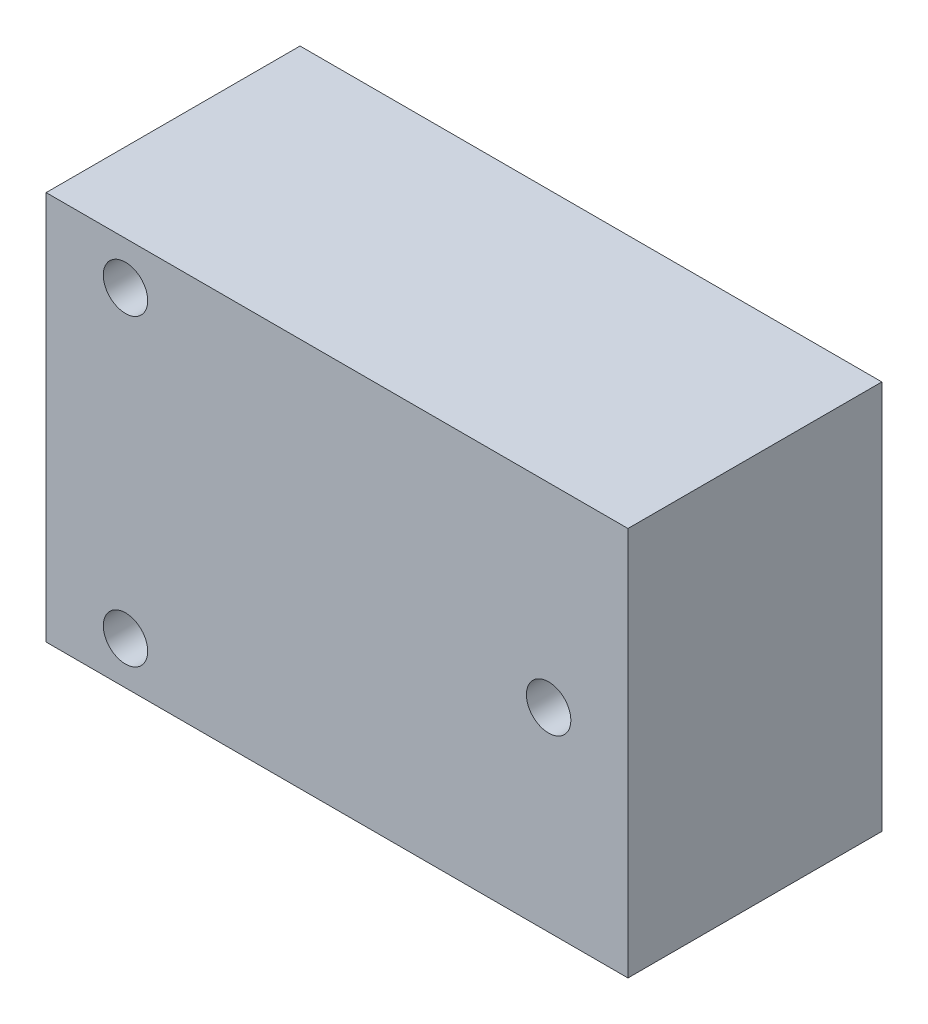
from build123d import *

# Parameters (mm, degrees)
SKETCH_1_W      = 55
SKETCH_1_H      = 36.8
SKETCH_1_R      = 2.1
EXTRUDE_1_DEPTH = 24


with BuildPart() as part:
    # 草图1 → 凸台-拉伸1 (new body)
    with BuildSketch(Plane.XY):
        Rectangle(SKETCH_1_W, SKETCH_1_H)
        with Locations((-20, 14.35)):
            Circle(SKETCH_1_R, mode=Mode.SUBTRACT)
        with Locations((20, 0)):
            Circle(SKETCH_1_R, mode=Mode.SUBTRACT)
        with Locations(Location((-20, -14.35, 0), (0, 0, 180))):
            Circle(SKETCH_1_R, mode=Mode.SUBTRACT)
    extrude(amount=EXTRUDE_1_DEPTH)


solid = part.part
